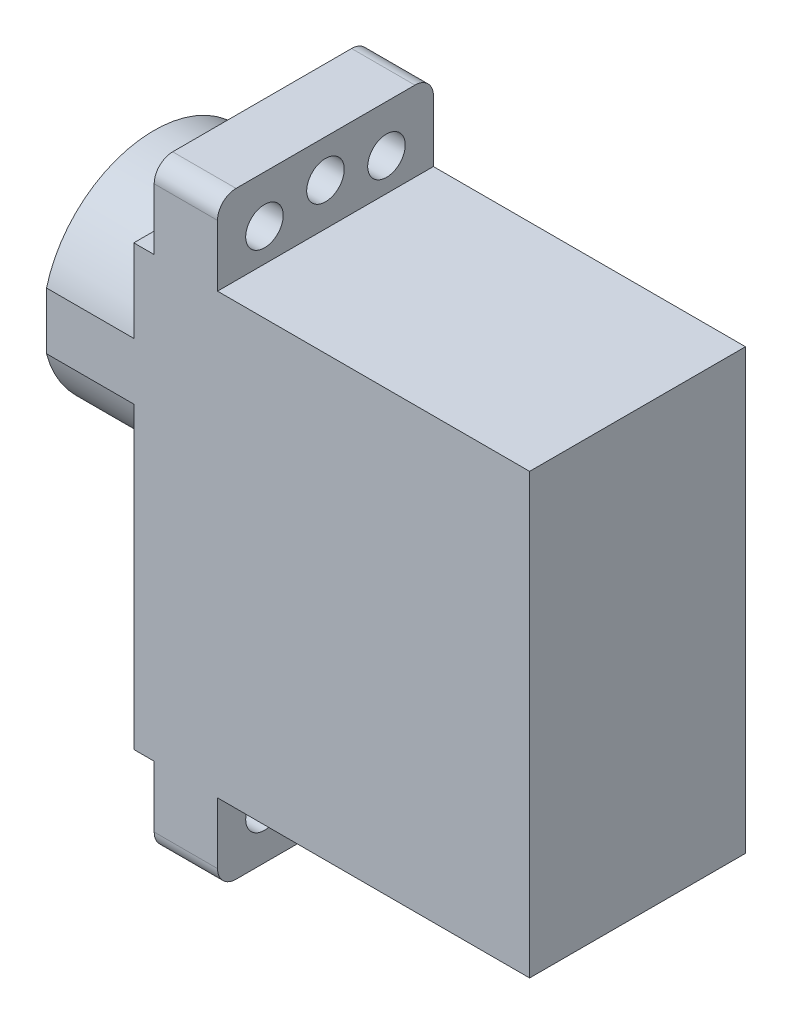
from build123d import *

# Parameters (mm, degrees)
ESQUISSE1_W             = 21.4234776
ESQUISSE1_H             = 23.749
BOSS_EXTRU_1_DEPTH      = 11.684
BOSS_EXTRU_2_DEPTH      = 4.318
BOSS_EXTRU_2_DEPTH_BACK = 28.067
ESQUISSE2_W             = 3.429
ESQUISSE2_H             = 11.684
ENL_V_MAT_EXTRU_1_REACH = 38.567
ESQUISSE4_R             = 1.016
CONG_1_R                = 1
ESQUISSE5_R             = 6.0198
BOSS_EXTRU_3_DEPTH      = 4.7244
ESQUISSE6_W             = 1
ESQUISSE6_H             = 23.749
ENL_V_MAT_EXTRU_2_DEPTH = 4.7244


with BuildPart() as part:
    # Esquisse1 → Boss.-Extru.1 (new body)
    with BuildSketch(Plane.XY):
        with Locations((10.7117388, 11.8745)):
            Rectangle(ESQUISSE1_W, ESQUISSE1_H)
    extrude(amount=BOSS_EXTRU_1_DEPTH)

    # Esquisse2 → Boss.-Extru.2 (add, two sides: drawn at the far end of the back side and taken through both)
    with BuildSketch(Plane.XZ.offset(-BOSS_EXTRU_2_DEPTH_BACK)):
        with Locations((2.8179776, 5.842)):
            Rectangle(ESQUISSE2_W, ESQUISSE2_H)
    extrude(amount=BOSS_EXTRU_2_DEPTH + BOSS_EXTRU_2_DEPTH_BACK)

    # Esquisse4 → Enlèv. mat.-Extru.1 (cut, up to next)
    with BuildSketch(Plane.ZY.offset(-1.1034776), mode=Mode.PRIVATE) as enl_v_mat_extru_1_sk1:
        with Locations((2.54, -1.778)):
            Circle(ESQUISSE4_R)
    enl_v_mat_extru_1_tool1 = extrude(enl_v_mat_extru_1_sk1.sketch, amount=-ENL_V_MAT_EXTRU_1_REACH, mode=Mode.PRIVATE) & part.part
    # Esquisse4 → Enlèv. mat.-Extru.1 (cut, up to next)
    with BuildSketch(Plane.ZY.offset(-1.1034776), mode=Mode.PRIVATE) as enl_v_mat_extru_1_sk2:
        with Locations((5.842, -2.286)):
            Circle(ESQUISSE4_R)
    enl_v_mat_extru_1_tool2 = extrude(enl_v_mat_extru_1_sk2.sketch, amount=-ENL_V_MAT_EXTRU_1_REACH, mode=Mode.PRIVATE) & part.part
    # Esquisse4 → Enlèv. mat.-Extru.1 (cut, up to next)
    with BuildSketch(Plane.ZY.offset(-1.1034776), mode=Mode.PRIVATE) as enl_v_mat_extru_1_sk3:
        with Locations((9.144, -1.778)):
            Circle(ESQUISSE4_R)
    enl_v_mat_extru_1_tool3 = extrude(enl_v_mat_extru_1_sk3.sketch, amount=-ENL_V_MAT_EXTRU_1_REACH, mode=Mode.PRIVATE) & part.part
    # Esquisse4 → Enlèv. mat.-Extru.1 (cut, up to next)
    with BuildSketch(Plane.ZY.offset(-1.1034776), mode=Mode.PRIVATE) as enl_v_mat_extru_1_sk4:
        with Locations(Location((9.144, 25.527, 0), (0, 0, 180))):
            Circle(ESQUISSE4_R)
    enl_v_mat_extru_1_tool4 = extrude(enl_v_mat_extru_1_sk4.sketch, amount=-ENL_V_MAT_EXTRU_1_REACH, mode=Mode.PRIVATE) & part.part
    # Esquisse4 → Enlèv. mat.-Extru.1 (cut, up to next)
    with BuildSketch(Plane.ZY.offset(-1.1034776), mode=Mode.PRIVATE) as enl_v_mat_extru_1_sk5:
        with Locations(Location((5.842, 26.035, 0), (0, 0, 180))):
            Circle(ESQUISSE4_R)
    enl_v_mat_extru_1_tool5 = extrude(enl_v_mat_extru_1_sk5.sketch, amount=-ENL_V_MAT_EXTRU_1_REACH, mode=Mode.PRIVATE) & part.part
    # Esquisse4 → Enlèv. mat.-Extru.1 (cut, up to next)
    with BuildSketch(Plane.ZY.offset(-1.1034776), mode=Mode.PRIVATE) as enl_v_mat_extru_1_sk6:
        with Locations(Location((2.54, 25.527, 0), (0, 0, 180))):
            Circle(ESQUISSE4_R)
    enl_v_mat_extru_1_tool6 = extrude(enl_v_mat_extru_1_sk6.sketch, amount=-ENL_V_MAT_EXTRU_1_REACH, mode=Mode.PRIVATE) & part.part
    add(enl_v_mat_extru_1_tool1.solids().sort_by_distance((1.103478, -1.778, 2.54))[0], mode=Mode.SUBTRACT)
    add(enl_v_mat_extru_1_tool2.solids().sort_by_distance((1.103478, -2.286, 5.842))[0], mode=Mode.SUBTRACT)
    add(enl_v_mat_extru_1_tool3.solids().sort_by_distance((1.103478, -1.778, 9.144))[0], mode=Mode.SUBTRACT)
    add(enl_v_mat_extru_1_tool4.solids().sort_by_distance((1.103478, 25.527, 9.144))[0], mode=Mode.SUBTRACT)
    add(enl_v_mat_extru_1_tool5.solids().sort_by_distance((1.103478, 26.035, 5.842))[0], mode=Mode.SUBTRACT)
    add(enl_v_mat_extru_1_tool6.solids().sort_by_distance((1.103478, 25.527, 2.54))[0], mode=Mode.SUBTRACT)

    # Congé1
    cong_1_edges = [part.edges().sort_by_distance(p)[0] for p in [
        (2.8179776, 28.067, 11.684),
        (2.8179776, 28.067, 0),
        (2.8179776, -4.318, 0),
        (2.8179776, -4.318, 11.684),
    ]]
    fillet(cong_1_edges, radius=CONG_1_R)

    # Esquisse5 → Boss.-Extru.3 (add)
    with BuildSketch(Plane.ZY):
        with Locations(Location((5.864615101, 17.7292, 0), (0, 0, 166.962066999))):
            Circle(ESQUISSE5_R)
    extrude(amount=BOSS_EXTRU_3_DEPTH)

    # Esquisse6 → Enlèv. mat.-Extru.2 (cut)
    with BuildSketch(Plane.ZY):
        with Locations((12.184, 11.8745)):
            Rectangle(ESQUISSE6_W, ESQUISSE6_H)
        with Locations((-0.5, 11.8745)):
            Rectangle(ESQUISSE6_W, ESQUISSE6_H)
    extrude(amount=ENL_V_MAT_EXTRU_2_DEPTH, mode=Mode.SUBTRACT)


solid = part.part
